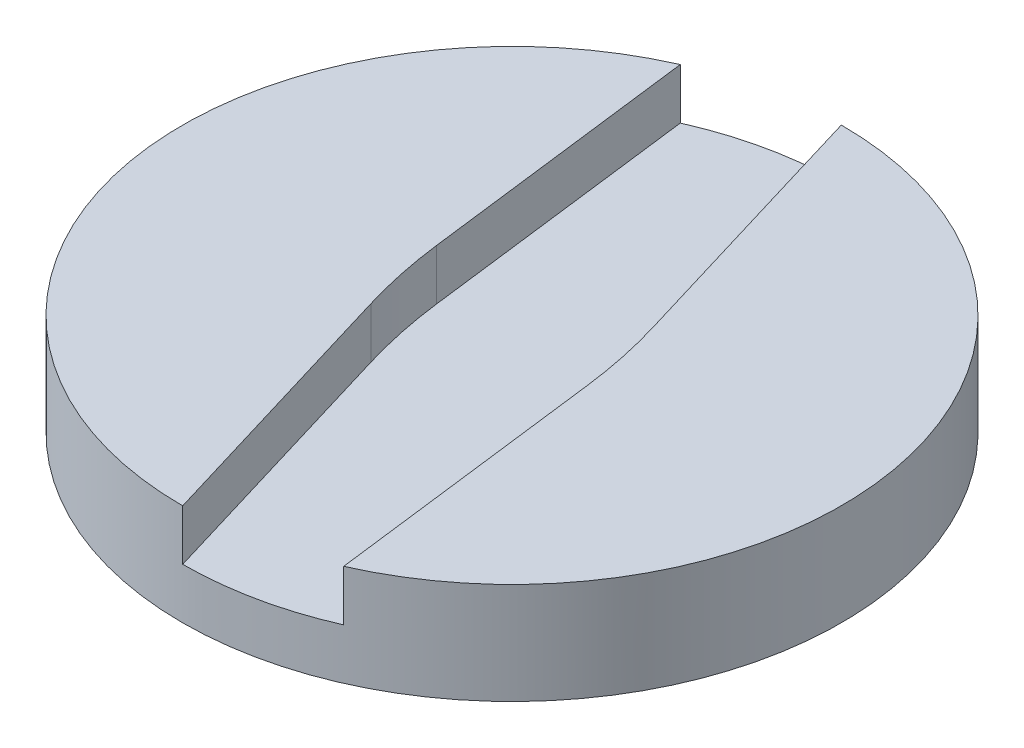
from build123d import *

# Parameters (mm, degrees)
CROQUIS1_R              = 13
SALIENTE_EXTRUIR1_DEPTH = 4
CORTAR_EXTRUIR1_DEPTH   = 2


with BuildPart() as part:
    # Croquis1 → Saliente-Extruir1 (new body)
    with BuildSketch(Plane(origin=(0, 0, 0), x_dir=(1, 0, 0), z_dir=(0, 1, 0))):
        with Locations(Location((0, 0, 0), (0, 0, 270))):
            Circle(CROQUIS1_R)
    extrude(amount=SALIENTE_EXTRUIR1_DEPTH)

    # Croquis4 → Cortar-Extruir1 (cut)
    with BuildSketch(Plane(origin=(0, 4, 0), x_dir=(1, 0, 0), z_dir=(0, 1, 0))):
        with BuildLine():
            Line((-3.184010772, -2.387150019), (0.656665628, -15.151411134))
            ThreePointArc((0.656665628, -15.151411134), (3.567700163, -16.877026265), (5.531329778, -14.120936937))
            Line((5.531329778, -14.120936937), (3.877699322, -0.894347681))
            ThreePointArc((3.877699322, -0.894347681), (3.756105044, -0.063772705), (3.599765133, 0.76096834))
            ThreePointArc((3.599765133, 0.76096834), (3.408954999, 1.57842259), (3.184010772, 2.387150019))
            Line((3.184010772, 2.387150019), (-0.656665628, 15.151411134))
            ThreePointArc((-0.656665628, 15.151411134), (-3.567700163, 16.877026265), (-5.531329778, 14.120936937))
            Line((-5.531329778, 14.120936937), (-3.877699322, 0.894347681))
            ThreePointArc((-3.877699322, 0.894347681), (-3.756105044, 0.063772705), (-3.599765133, -0.76096834))
            ThreePointArc((-3.599765133, -0.76096834), (-3.408954999, -1.57842259), (-3.184010772, -2.387150019))
        make_face()
    extrude(amount=-CORTAR_EXTRUIR1_DEPTH, mode=Mode.SUBTRACT)


solid = part.part
